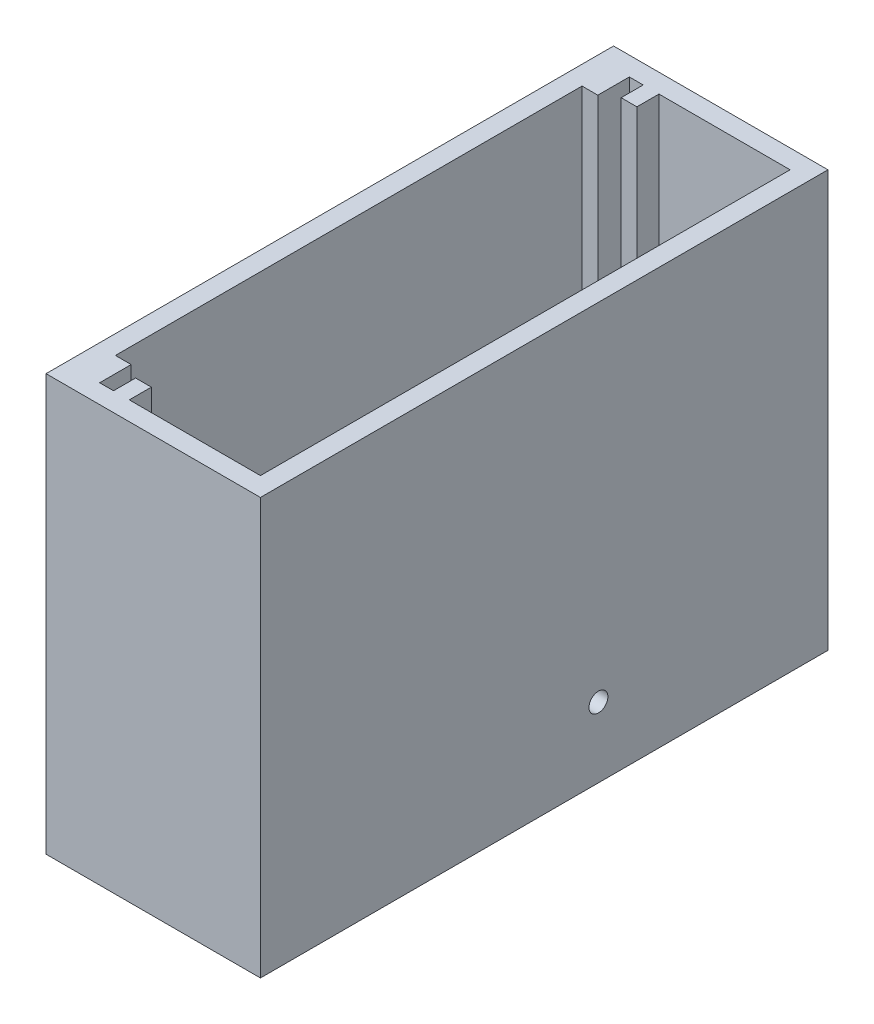
from build123d import *

# Parameters (mm, degrees)
ESBO_O1_W                = 34
ESBO_O1_H                = 90
RESSALTO_EXTRUS_O1_DEPTH = 63
ESBO_O2_W                = 34
ESBO_O2_H                = 90
RESSALTO_EXTRUS_O2_DEPTH = 3
ESBO_O3_R                = 1.5
CORTE_EXTRUS_O1_DEPTH    = 3


with BuildPart() as part:
    # Esboço1 → Ressalto-extrusão1 (new body)
    with BuildSketch(Plane(origin=(0, 0, 0), x_dir=(1, 0, 0), z_dir=(0, 1, 0))):
        with Locations((17, 45)):
            Rectangle(ESBO_O1_W, ESBO_O1_H)
        Polygon((5.5, 8), (3, 8), (3, 82), (5.5, 82), (5.5, 87), (7.7, 87), (7.7, 83.5), (10.2, 83.5), (10.2, 87), (31, 87), (31, 3), (10.2, 3), (10.2, 6.5), (7.7, 6.5), (7.7, 3), (5.5, 3), align=None, mode=Mode.SUBTRACT)
    extrude(amount=RESSALTO_EXTRUS_O1_DEPTH)

    # Esboço2 → Ressalto-extrusão2 (add)
    with BuildSketch(Plane.XZ):
        with Locations((17, -45)):
            Rectangle(ESBO_O2_W, ESBO_O2_H)
    extrude(amount=RESSALTO_EXTRUS_O2_DEPTH)

    # Esboço3 → Corte-extrusão1 (cut)
    with BuildSketch(Plane(origin=(34, 0, 0), x_dir=(0, 0, -1), z_dir=(1, 0, 0))):
        with Locations((53.6, 8.1)):
            Circle(ESBO_O3_R)
    extrude(amount=-CORTE_EXTRUS_O1_DEPTH, mode=Mode.SUBTRACT)


solid = part.part
